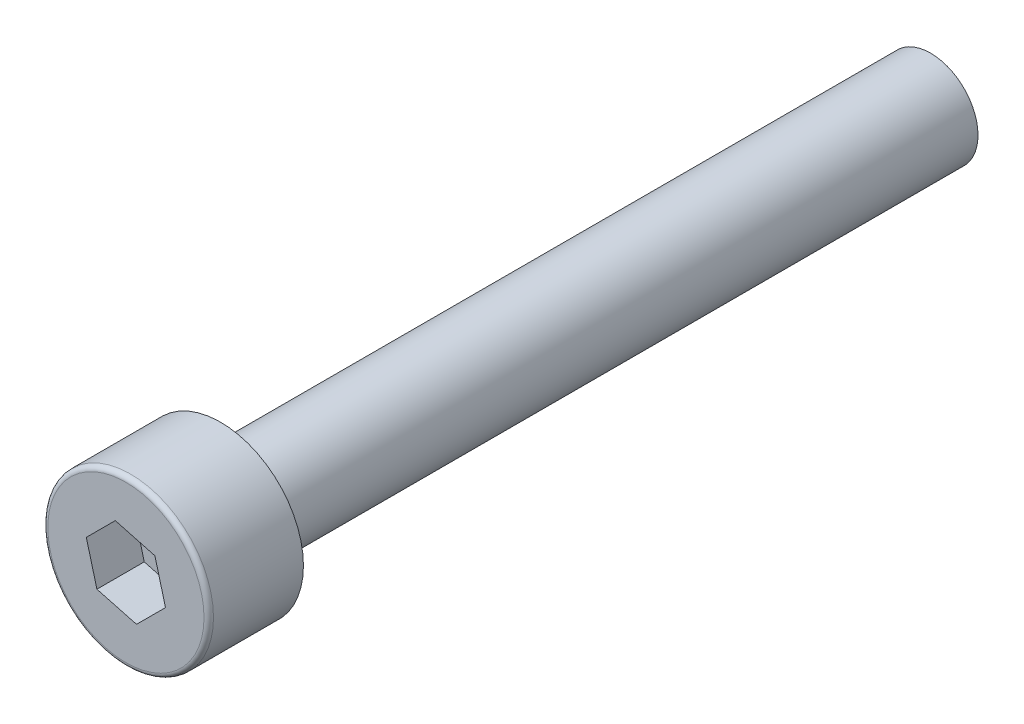
from build123d import *

# Parameters (mm, degrees)
SKETCH_1_R          = 3.5
EXTRUDE_1_DEPTH     = 4
CUT_EXTRUDE_1_DEPTH = 2
SKETCH_3_R          = 2
EXTRUDE_2_DEPTH     = 30
FILLET_1_R          = 0.2


with BuildPart() as part:
    # 草图1 → 凸台-拉伸1 (new body)
    with BuildSketch(Plane.XY):
        Circle(SKETCH_1_R)
    extrude(amount=EXTRUDE_1_DEPTH)

    # 草图2 → 切除-拉伸1 (cut)
    with BuildSketch(Plane.XY.offset(4)):
        Polygon((-1.224744871, -1.224744871), (0.448287736, -1.673032607), (1.673032607, -0.448287736), (1.224744871, 1.224744871), (-0.448287736, 1.673032607), (-1.673032607, 0.448287736), align=None)
    extrude(amount=-CUT_EXTRUDE_1_DEPTH, mode=Mode.SUBTRACT)

    # 草图3 → 凸台-拉伸2 (add)
    with BuildSketch(Plane(origin=(0, 0, 0), x_dir=(-1, 0, 0), z_dir=(0, 0, -1))):
        with Locations(Location((0, 0, 0), (0, 0, 180))):
            Circle(SKETCH_3_R)
    extrude(amount=EXTRUDE_2_DEPTH)

    # 圆角1
    fillet_1_edges = [part.edges().sort_by_distance(p)[0] for p in [
        (-3.5, 0, 4),
    ]]
    fillet(fillet_1_edges, radius=FILLET_1_R)


solid = part.part
